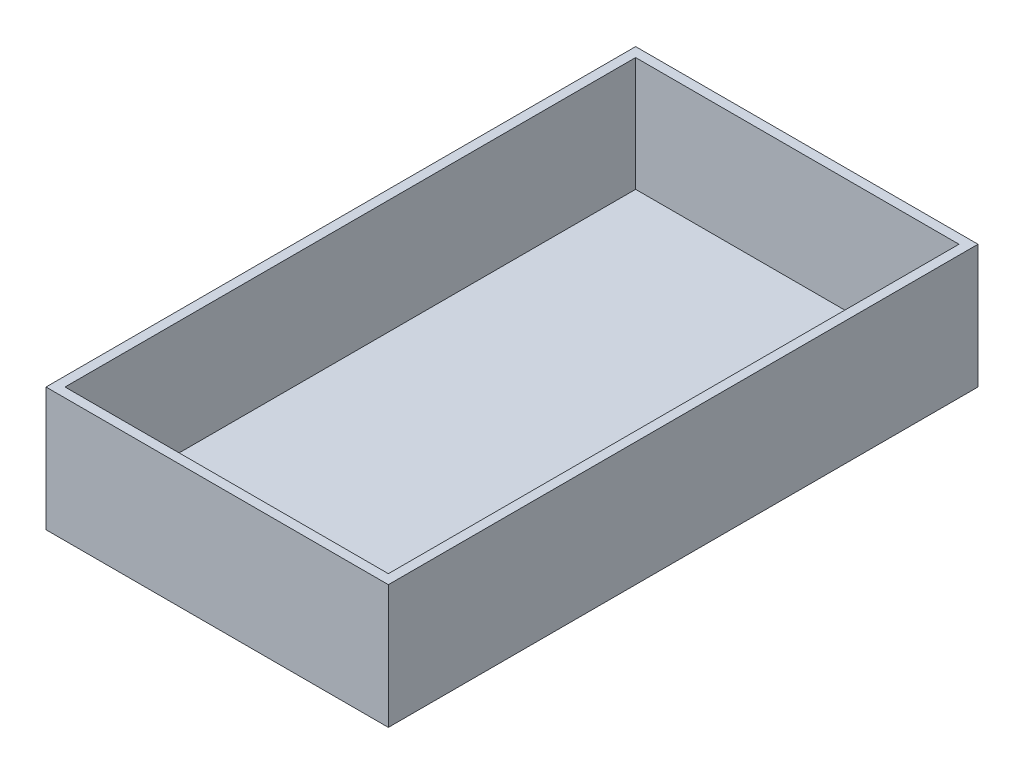
from build123d import *

# Parameters (mm, degrees)
SKETCH1_W           = 18000
SKETCH1_H           = 31000
SKETCH1_W_2         = 17000
SKETCH1_H_2         = 30000
BOSS_EXTRUDE2_DEPTH = 6000
SKETCH2_W           = 18000
SKETCH2_H           = 500
BOSS_EXTRUDE3_DEPTH = 31000


with BuildPart() as part:
    # Sketch1 → Boss-Extrude2 (new body)
    with BuildSketch(Plane(origin=(0, 0, 0), x_dir=(1, 0, 0), z_dir=(0, 1, 0))):
        Rectangle(SKETCH1_W, SKETCH1_H)
        Rectangle(SKETCH1_W_2, SKETCH1_H_2, mode=Mode.SUBTRACT)
    extrude(amount=BOSS_EXTRUDE2_DEPTH)

    # Sketch2 → Boss-Extrude3 (add)
    with BuildSketch(Plane.XY.offset(15500)):
        with Locations((0, -250)):
            Rectangle(SKETCH2_W, SKETCH2_H)
    extrude(amount=-BOSS_EXTRUDE3_DEPTH)


solid = part.part
